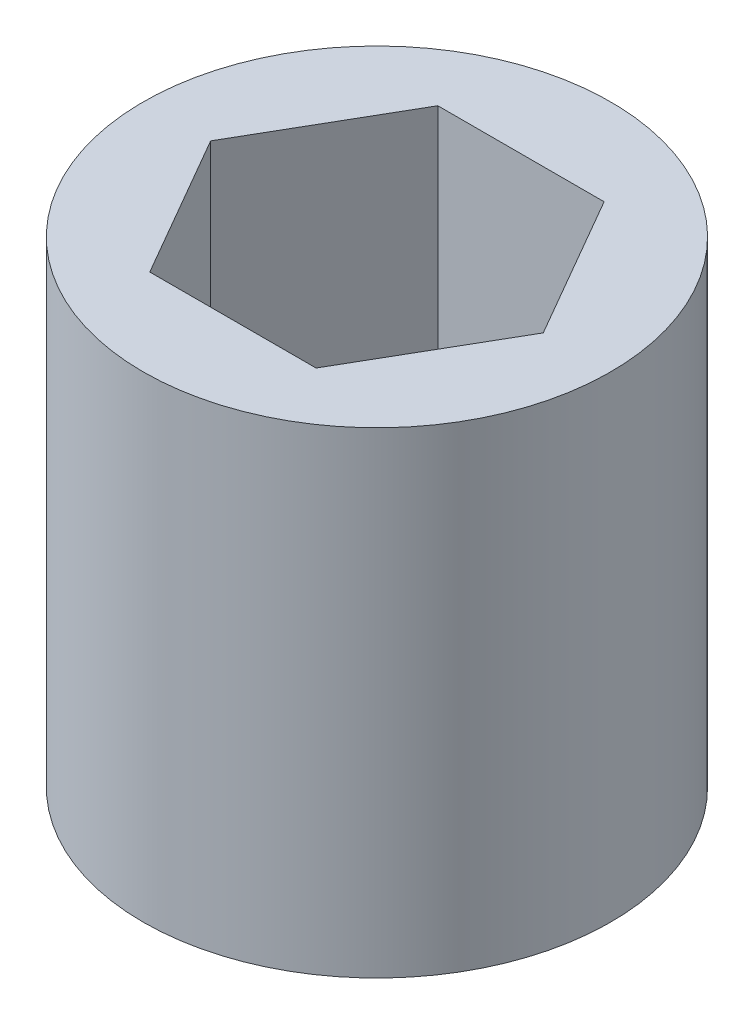
from build123d import *

# Parameters (mm, degrees)
SKETCH1_R           = 7.9375
BOSS_EXTRUDE1_DEPTH = 16.1798


with BuildPart() as part:
    # Sketch1 → Boss-Extrude1 (new body)
    with BuildSketch(Plane(origin=(0, 0, 0), x_dir=(1, 0, 0), z_dir=(0, 1, 0))):
        with Locations(Location((0, 0, 0), (0, 0, 270))):
            Circle(SKETCH1_R)
        Polygon((5.645908282, 0), (2.822954141, 4.8895), (-2.822954141, 4.8895), (-5.645908282, 0), (-2.822954141, -4.8895), (2.822954141, -4.8895), align=None, mode=Mode.SUBTRACT)
    extrude(amount=BOSS_EXTRUDE1_DEPTH)


solid = part.part
